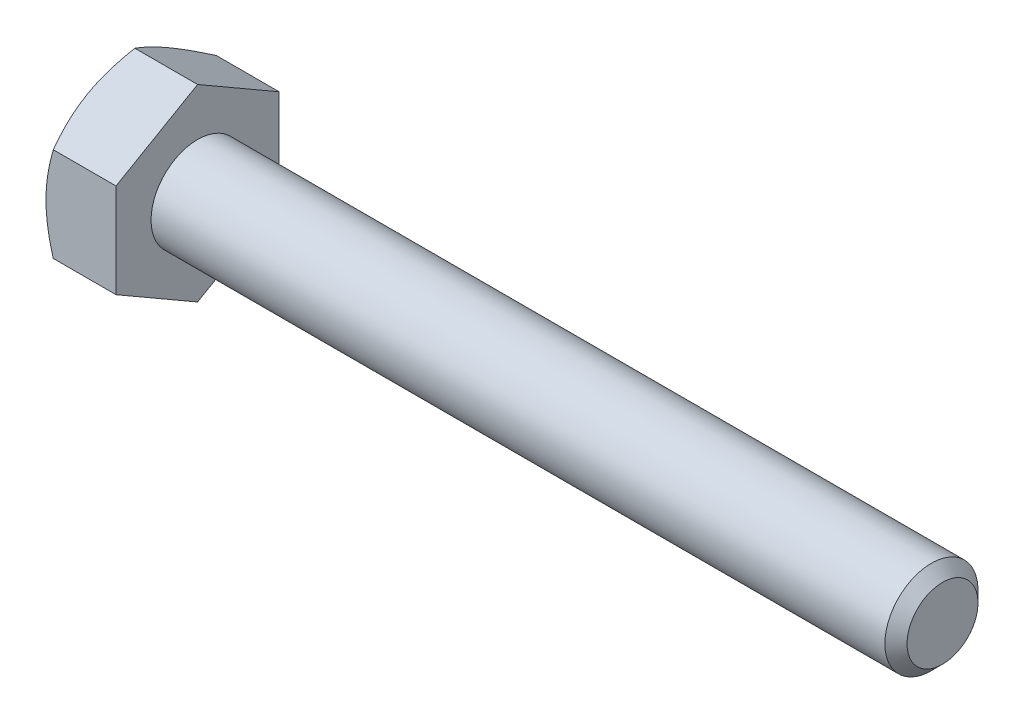
from build123d import *

# Parameters (mm, degrees)
BASEHEAD_DEPTH = 4.7752


with BuildPart() as part:
    # Sketch1 → BaseHead (new body)
    with BuildSketch(Plane(origin=(0, 0, 0), x_dir=(0, 0, -1), z_dir=(1, 0, 0))):
        Polygon((5.5626, 3.211568607), (5.5626, -3.211568607), (0, -6.423137215), (-5.5626, -3.211568607), (-5.5626, 3.211568607), (0, 6.423137215), align=None)
    extrude(amount=BASEHEAD_DEPTH)

    # BodySke → BaseBody (revolve)
    with BuildSketch(Plane.XY, mode=Mode.PRIVATE) as basebody_sk:
        Polygon((0, 0), (55.5752, 0), (55.5752, 2.41935), (54.81955, 3.175), (0, 3.175), align=None)
    revolve(basebody_sk.sketch.rotate(Axis((0, 0, 0), (1, 0, 0)), 90), axis=Axis((0, 0, 0), (1, 0, 0)))

    # Sketch3 → HeadChamfer (revolve, cut)
    with BuildSketch(Plane.XY):
        Polygon((0, 5.5626), (4.163005602, 12.773137215), (4.163005602, 19.123137215), (-12.7, 19.123137215), (-12.7, 5.5626), align=None)
    revolve(axis=Axis((0, 0, 0), (1, 0, 0)), mode=Mode.SUBTRACT)


solid = part.part
